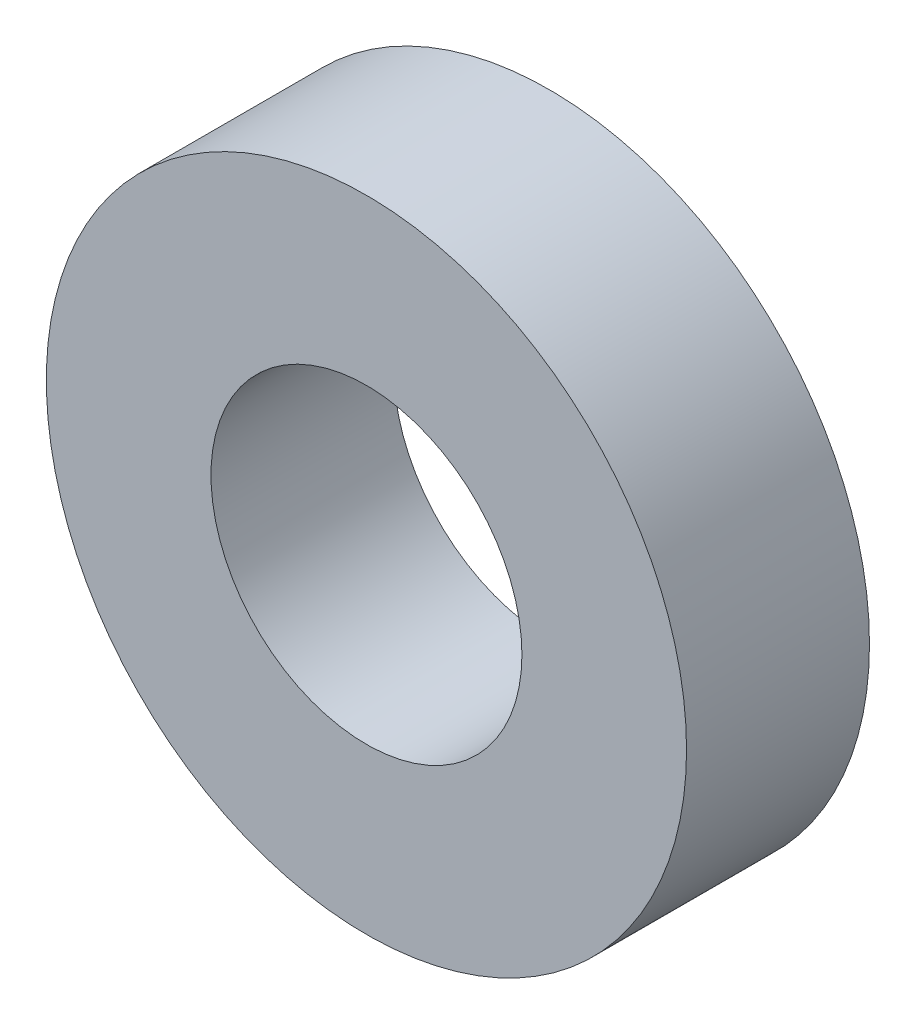
from build123d import *

# Parameters (mm, degrees)
SKETCH1_R           = 17.5
SKETCH1_R_2         = 8.5
BOSS_EXTRUDE1_DEPTH = 10


with BuildPart() as part:
    # Sketch1 → Boss-Extrude1 (new body)
    with BuildSketch(Plane.XY):
        Circle(SKETCH1_R)
        Circle(SKETCH1_R_2, mode=Mode.SUBTRACT)
    extrude(amount=BOSS_EXTRUDE1_DEPTH)


solid = part.part
